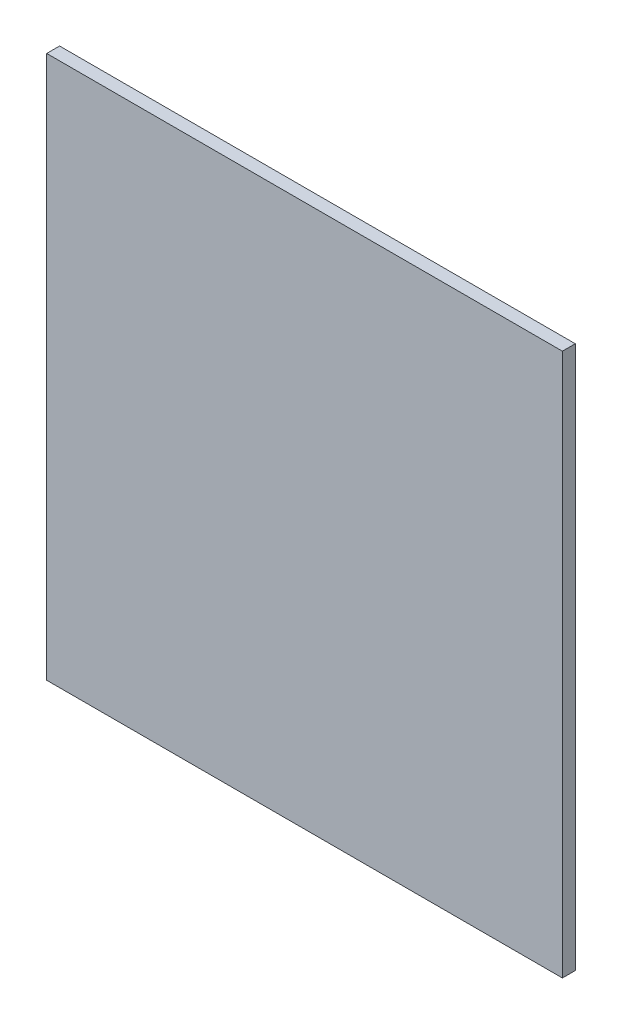
from build123d import *

# Parameters (mm, degrees)
SKIZZE1_W                       = 760
SKIZZE1_H                       = 800
AUFSATZ_LINEAR_AUSTRAGEN1_DEPTH = 9.5


with BuildPart() as part:
    # Skizze1 → Aufsatz-Linear austragen1 (new, symmetric)
    with BuildSketch(Plane.XY):
        Rectangle(SKIZZE1_W, SKIZZE1_H)
    extrude(amount=AUFSATZ_LINEAR_AUSTRAGEN1_DEPTH, both=True)


solid = part.part
